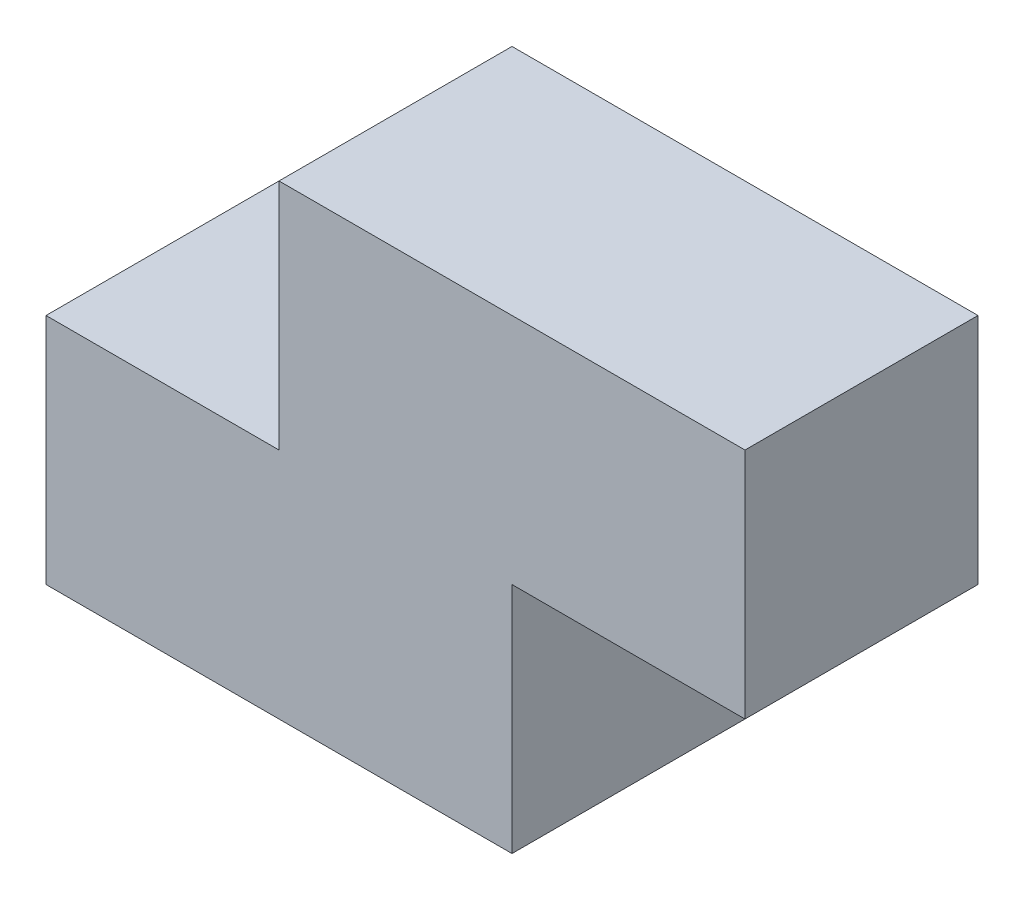
from build123d import *

# Parameters (mm, degrees)
BOSS_EXTRU_1_DEPTH = 10


with BuildPart() as part:
    # Esquisse1 → Boss.-Extru.1 (new body)
    with BuildSketch(Plane.XY):
        Polygon((0, 0), (0, 10), (10, 10), (10, 20), (30, 20), (30, 10), (20, 10), (20, 0), align=None)
    extrude(amount=-BOSS_EXTRU_1_DEPTH)


solid = part.part
